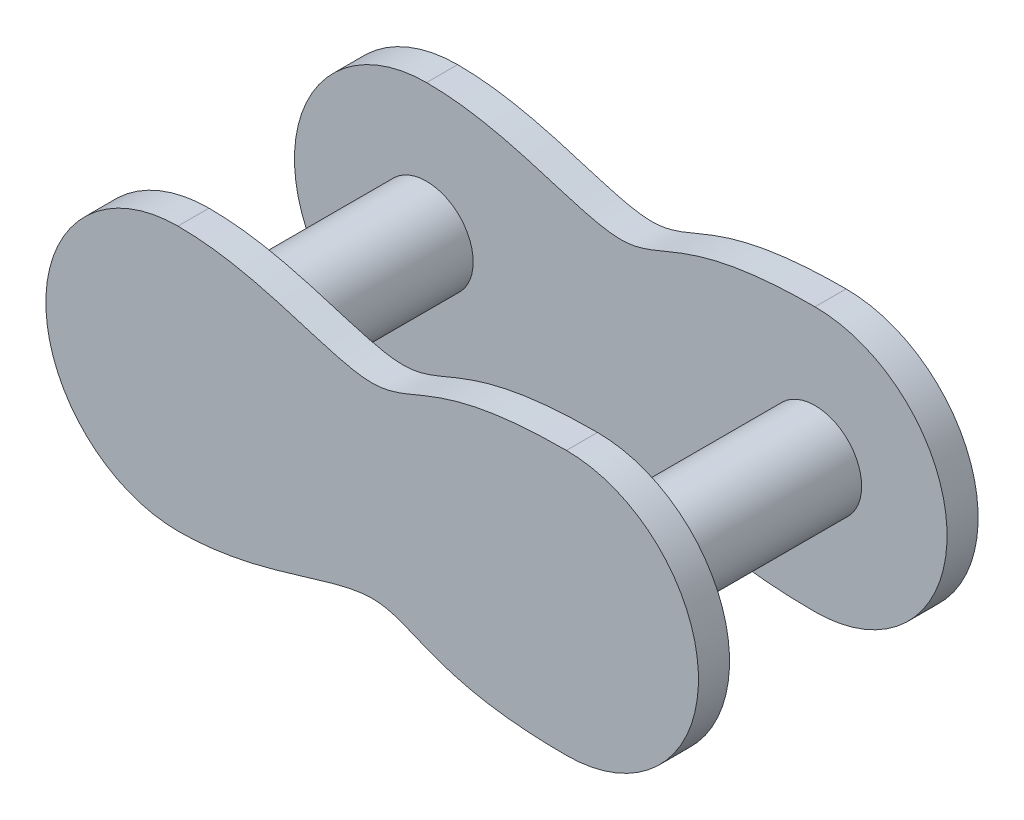
from build123d import *

# Parameters (mm, degrees)
SKETCH1_R             = 1.5
BOSS_EXTRUDE1_DEPTH   = 7
BOSS_EXTRUDE1_2_DEPTH = 7
BOSS_EXTRUDE2_DEPTH   = 1
BOSS_EXTRUDE3_DEPTH   = 1


with BuildPart() as part:
    # Sketch1 → Boss-Extrude1 (new body)
    with BuildSketch(Plane.XY):
        Circle(SKETCH1_R)
    extrude(amount=BOSS_EXTRUDE1_DEPTH)



with BuildPart() as body_2:
    # Sketch1 → Boss-Extrude1 2 (new body)
    with BuildSketch(Plane.XY):
        with Locations((12.5, 0)):
            Circle(SKETCH1_R)
    extrude(amount=BOSS_EXTRUDE1_2_DEPTH)


with BuildPart() as part_1:
    add(part.part)

    add(body_2.part)  # Boss-Extrude2 merges body 2
    # Sketch2 → Boss-Extrude2 (add)
    with BuildSketch(Plane.XY.offset(7)):
        with BuildLine():
            ThreePointArc((0, 4.25), (-4.25, 0), (0, -4.25))
            add(Edge.make_bspline(
                [(0, -4.25), (2.67403161, -4.25), (7.063884677, -1.75), (8.198199037, -4.25), (12.5, -4.25)],
                knots=[0, 0, 0, 0, 0.5, 1, 1, 1, 1], degree=3))
            ThreePointArc((12.5, -4.25), (16.75, 0), (12.5, 4.25))
            add(Edge.make_bspline(
                [(0, 4.25), (2.67403161, 4.25), (7.063884677, 1.75), (8.198199037, 4.25), (12.5, 4.25)],
                knots=[0, 0, 0, 0, 0.5, 1, 1, 1, 1], degree=3))
        make_face()
    extrude(amount=BOSS_EXTRUDE2_DEPTH)


with BuildPart() as body_2_2:
    # Sketch3 → Boss-Extrude3 (new body)
    with BuildSketch(Plane(origin=(0, 0, 0), x_dir=(-1, 0, 0), z_dir=(0, 0, -1))):
        with BuildLine():
            ThreePointArc((0, -4.25), (4.25, 0), (0, 4.25))
            add(Edge.make_bspline(
                [(-12.5, 4.25), (-8.198199037, 4.25), (-7.063884677, 1.75), (-2.67403161, 4.25), (0, 4.25)],
                knots=[0, 0, 0, 0, 0.5, 1, 1, 1, 1], degree=3))
            ThreePointArc((-12.5, 4.25), (-16.75, 0), (-12.5, -4.25))
            add(Edge.make_bspline(
                [(0, -4.25), (-2.67403161, -4.25), (-7.063884677, -1.75), (-8.198199037, -4.25), (-12.5, -4.25)],
                knots=[0, 0, 0, 0, 0.5, 1, 1, 1, 1], degree=3))
        make_face()
    extrude(amount=BOSS_EXTRUDE3_DEPTH)


solid = Compound([part_1.part, body_2_2.part])
